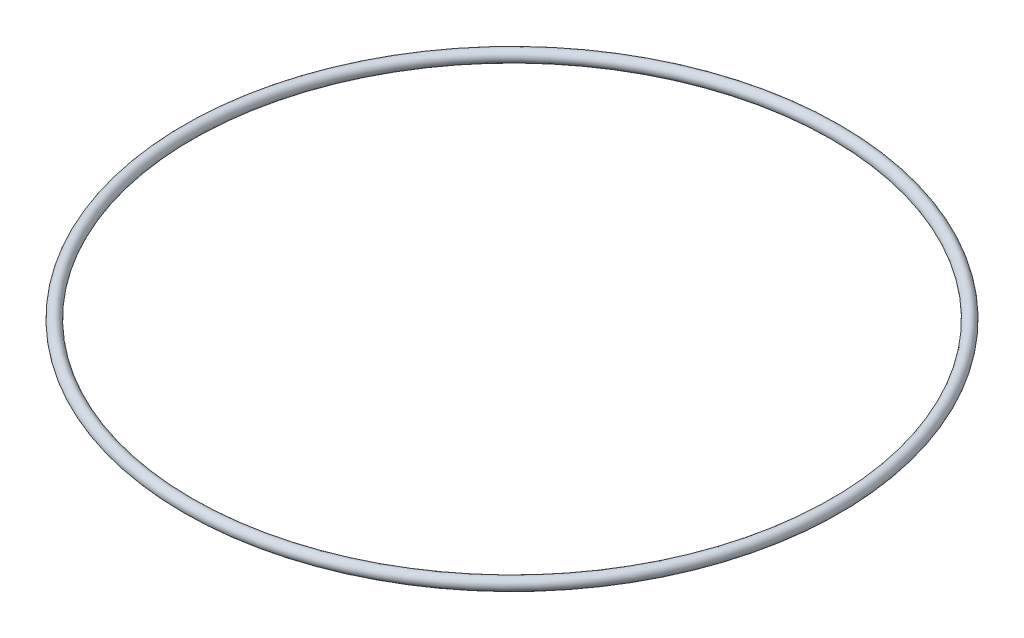
from build123d import *

# Parameters (mm, degrees)
SWEEP1_PROFILE_R = 0.508


with BuildPart() as part:
    # Sweep1: sweep along a path in Sketch1
    with BuildLine(Plane(origin=(0, 0, 0), x_dir=(1, 0, 0), z_dir=(0, 1, 0))) as sweep1_path:
        CenterArc((0, 0), 27.94, 0, 360)
    # Sweep1 profile (on start of the path) → Sweep1 (sweep)
    with BuildSketch(Plane(origin=(27.94, 0, 0), x_dir=(-1, 0, 0), z_dir=(0, 0, -1))):
        Circle(SWEEP1_PROFILE_R)
    sweep(path=sweep1_path.line)


solid = part.part
